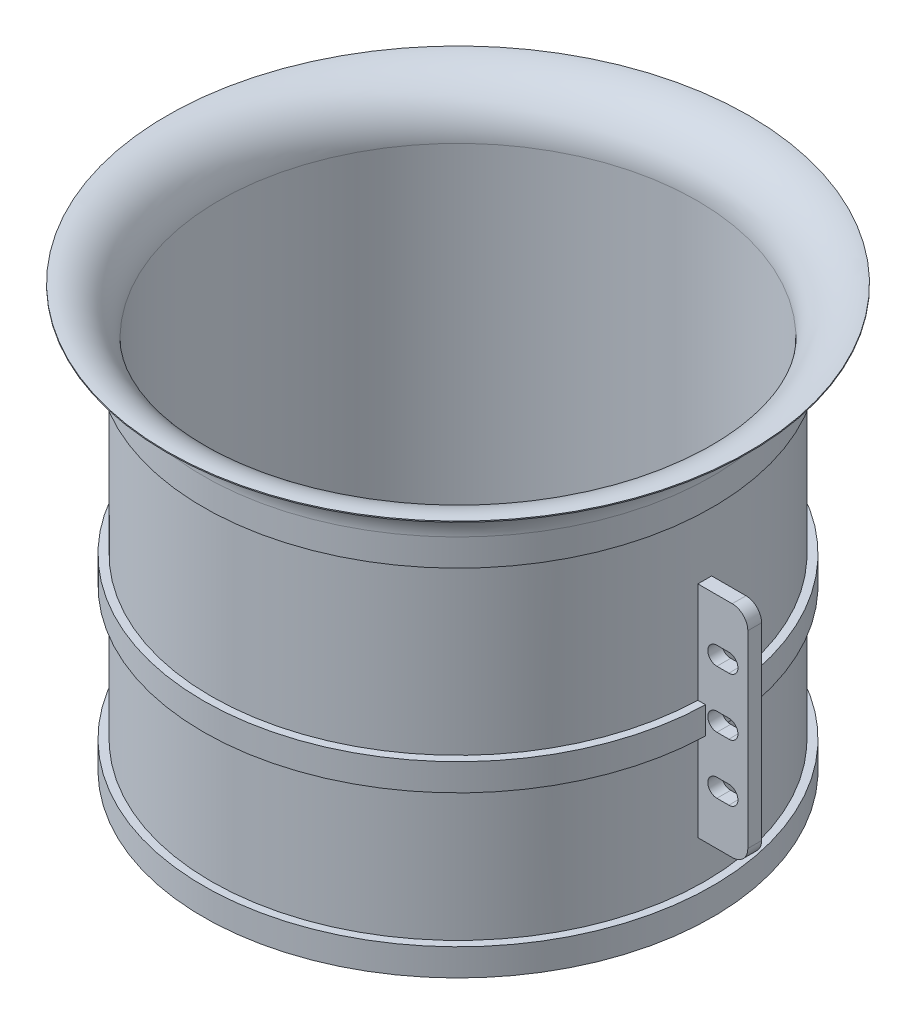
from build123d import *

# Parameters (mm, degrees)
SKETCH3_W            = 11.1
SKETCH3_H            = 42.3
BOSS_EXTRUDE1_DEPTH  = 1.325
FILLET1_R            = 3
FILLET1_OF_MIRROR1_R = 3


with BuildPart() as part:
    # Sketch2 → Revolve1 (revolve)
    with BuildSketch(Plane.XY):
        with BuildLine():
            Line((46, 0), (46, 71.93668826))
            ThreePointArc((46, 71.93668826), (48.984023168, 78.718396784), (56, 81.1))
            Line((56, 81.1), (56, 80.9))
            ThreePointArc((56, 80.9), (51.02725979, 78.593132631), (49, 73.5))
            Line((49, 73.5), (49, 68.3))
            Line((49, 68.3), (47.5, 68.3))
            Line((47.5, 68.3), (47.5, 36.05))
            Line((47.5, 36.05), (49, 36.05))
            Line((49, 36.05), (49, 30.85))
            Line((49, 30.85), (47.5, 30.85))
            Line((47.5, 30.85), (47.5, 5.2))
            Line((47.5, 5.2), (49, 5.2))
            Line((49, 5.2), (49, 0))
            Line((49, 0), (46, 0))
        make_face()
    revolve(axis=Axis((0, 0, 0), (0, 1, 0)))

    # Sketch3 → Boss-Extrude1 (add, symmetric)
    with BuildSketch(Plane.XY):
        with Locations((51.55, 34.3)):
            Rectangle(SKETCH3_W, SKETCH3_H)
        with BuildLine():
            ThreePointArc((51.15, 21.55), (49.4, 23.3), (51.15, 25.05))
            Line((51.15, 25.05), (53.45, 25.05))
            ThreePointArc((53.45, 25.05), (55.2, 23.3), (53.45, 21.55))
            Line((53.45, 21.55), (51.15, 21.55))
        make_face(mode=Mode.SUBTRACT)
        with BuildLine():
            ThreePointArc((51.15, 32.55), (49.4, 34.3), (51.15, 36.05))
            Line((51.15, 36.05), (53.45, 36.05))
            ThreePointArc((53.45, 36.05), (55.2, 34.3), (53.45, 32.55))
            Line((53.45, 32.55), (51.15, 32.55))
        make_face(mode=Mode.SUBTRACT)
        with BuildLine():
            Line((53.45, 43.55), (51.15, 43.55))
            ThreePointArc((51.15, 43.55), (49.4, 45.3), (51.15, 47.05))
            Line((51.15, 47.05), (53.45, 47.05))
            ThreePointArc((53.45, 47.05), (55.2, 45.3), (53.45, 43.55))
        make_face(mode=Mode.SUBTRACT)
    boss_extrude1 = extrude(amount=BOSS_EXTRUDE1_DEPTH, both=True)

    # Fillet1
    fillet1_edges = [part.edges().sort_by_distance(p)[0] for p in [
        (57.1, 13.15, 0),
        (57.1, 55.45, 0),
    ]]
    fillet(fillet1_edges, radius=FILLET1_R)

    # Mirror1: Boss-Extrude1 across plane
    add(boss_extrude1.mirror(Plane(origin=(0, 0, 0), x_dir=(0, 0, 1), z_dir=(1, 0, 0))))

    # Fillet1 of Mirror1
    fillet1_of_mirror1_edges = [part.edges().sort_by_distance(p)[0] for p in [
        (-57.1, 13.15, 0),
        (-57.1, 55.45, 0),
    ]]
    fillet(fillet1_of_mirror1_edges, radius=FILLET1_OF_MIRROR1_R)


solid = part.part
